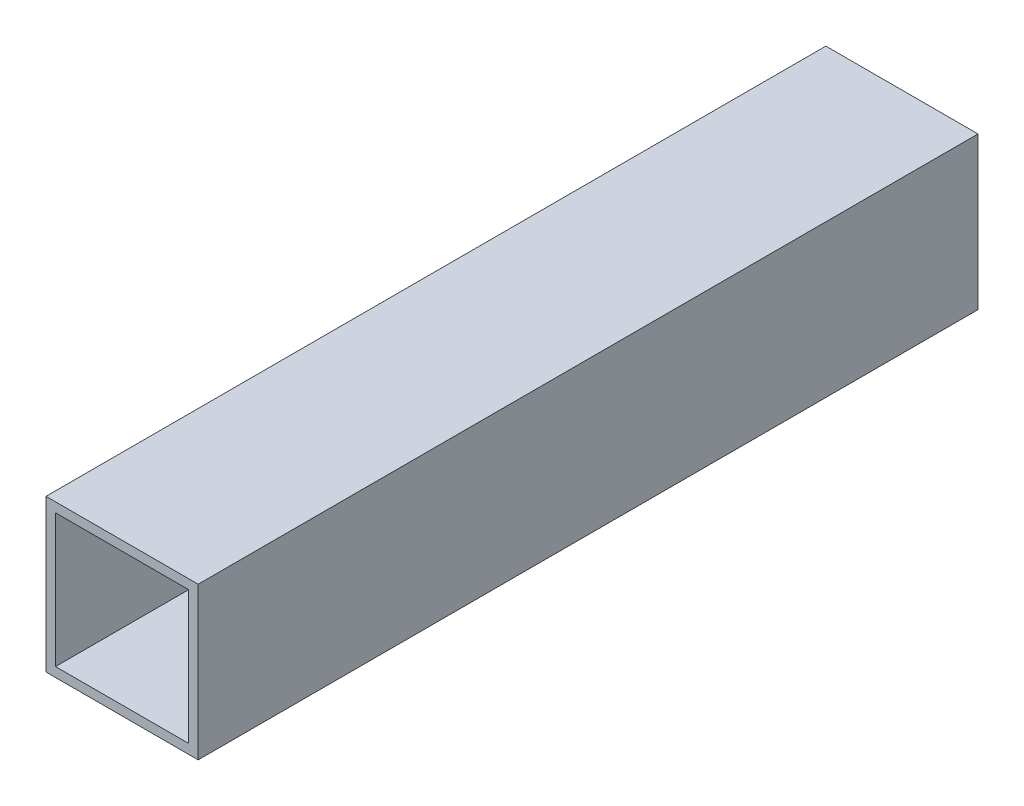
from build123d import *

# Parameters (mm, degrees)
SKETCH1_W           = 50.8
SKETCH1_H           = 50.8
SKETCH1_W_2         = 44.45
SKETCH1_H_2         = 44.45
BOSS_EXTRUDE1_DEPTH = 260.35


with BuildPart() as part:
    # Sketch1 → Boss-Extrude1 (new body)
    with BuildSketch(Plane.XY):
        Rectangle(SKETCH1_W, SKETCH1_H)
        Rectangle(SKETCH1_W_2, SKETCH1_H_2, mode=Mode.SUBTRACT)
    extrude(amount=BOSS_EXTRUDE1_DEPTH)


solid = part.part
